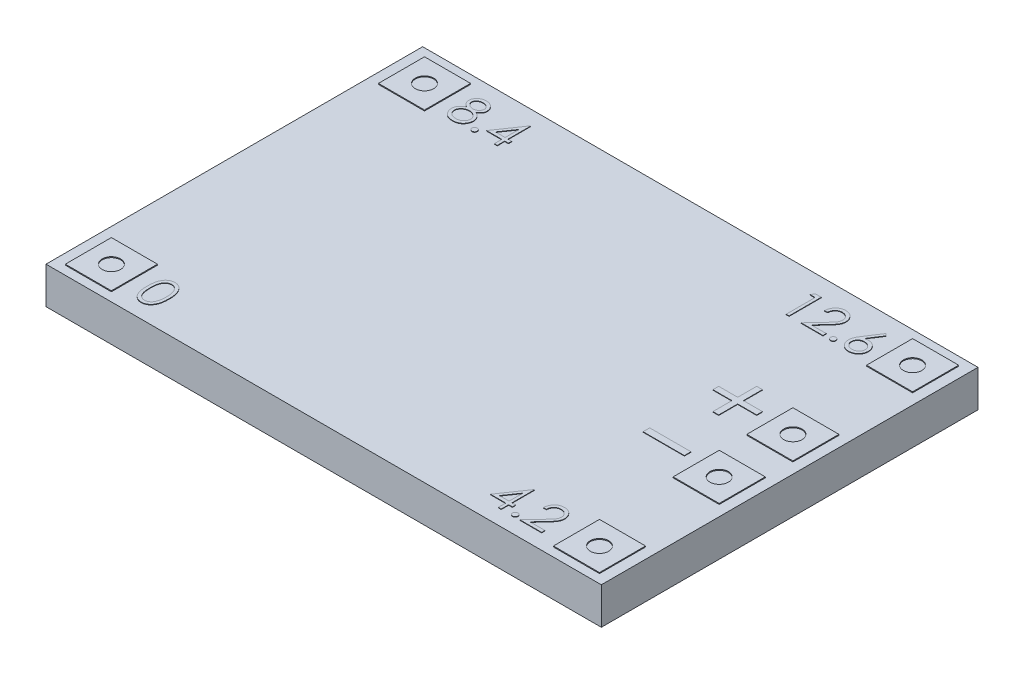
from build123d import *

# Parameters (mm, degrees)
SKETCH_1_W         = 60.3
SKETCH_1_H         = 40.9
EXTRUDE_1_DEPTH    = 4
SKETCH_2_W         = 5
SKETCH_2_H         = 5
SKETCH_2_R         = 1
EXTRUDE_2_DEPTH    = 0.1
EXTRUDE_2_2_DEPTH  = 0.1
EXTRUDE_2_3_DEPTH  = 0.1
EXTRUDE_2_4_DEPTH  = 0.1
EXTRUDE_2_5_DEPTH  = 0.1
EXTRUDE_2_6_DEPTH  = 0.1
EXTRUDE_3_DEPTH    = 0.05
SKETCH_3_W         = 4.487179487
SKETCH_3_H         = 0.717948718
EXTRUDE_3_2_DEPTH  = 0.05
EXTRUDE_3_3_DEPTH  = 0.05
EXTRUDE_3_4_DEPTH  = 0.05
EXTRUDE_3_5_DEPTH  = 0.05
EXTRUDE_3_6_DEPTH  = 0.05
EXTRUDE_3_7_DEPTH  = 0.05
EXTRUDE_3_8_DEPTH  = 0.05
EXTRUDE_3_9_DEPTH  = 0.05
EXTRUDE_3_10_DEPTH = 0.05
EXTRUDE_3_11_DEPTH = 0.05
EXTRUDE_3_12_DEPTH = 0.05
EXTRUDE_3_13_DEPTH = 0.05


with BuildPart() as part:
    # Эскиз1 → Бобышка-Вытянуть1 (new body)
    with BuildSketch(Plane(origin=(0, 0, 0), x_dir=(1, 0, 0), z_dir=(0, 1, 0))):
        Rectangle(SKETCH_1_W, SKETCH_1_H)
    extrude(amount=EXTRUDE_1_DEPTH)


with BuildPart() as body_2:
    # Эскиз2 → Бобышка-Вытянуть2 (new body)
    with BuildSketch(Plane(origin=(0, 4, 0), x_dir=(1, 0, 0), z_dir=(0, 1, 0))):
        with Locations((-26.5, -17)):
            Rectangle(SKETCH_2_W, SKETCH_2_H)
        with Locations(Location((-26.5, -17, 0), (0, 0, 270))):
            Circle(SKETCH_2_R, mode=Mode.SUBTRACT)
    extrude(amount=EXTRUDE_2_DEPTH)


with BuildPart() as body_3:
    # Эскиз2 → Extrude 2 2 (new body)
    with BuildSketch(Plane(origin=(0, 4, 0), x_dir=(1, 0, 0), z_dir=(0, 1, 0))):
        with Locations((-26.5, 17)):
            Rectangle(SKETCH_2_W, SKETCH_2_H)
        with Locations(Location((-26.5, 17, 0), (0, 0, 90))):
            Circle(SKETCH_2_R, mode=Mode.SUBTRACT)
    extrude(amount=EXTRUDE_2_2_DEPTH)


with BuildPart() as body_4:
    # Эскиз2 → Extrude 2 3 (new body)
    with BuildSketch(Plane(origin=(0, 4, 0), x_dir=(1, 0, 0), z_dir=(0, 1, 0))):
        with Locations((26.5, 17)):
            Rectangle(SKETCH_2_W, SKETCH_2_H)
        with Locations(Location((26.5, 17, 0), (0, 0, 270))):
            Circle(SKETCH_2_R, mode=Mode.SUBTRACT)
    extrude(amount=EXTRUDE_2_3_DEPTH)


with BuildPart() as body_5:
    # Эскиз2 → Extrude 2 4 (new body)
    with BuildSketch(Plane(origin=(0, 4, 0), x_dir=(1, 0, 0), z_dir=(0, 1, 0))):
        with Locations((26.5, -17)):
            Rectangle(SKETCH_2_W, SKETCH_2_H)
        with Locations(Location((26.5, -17, 0), (0, 0, 90))):
            Circle(SKETCH_2_R, mode=Mode.SUBTRACT)
    extrude(amount=EXTRUDE_2_4_DEPTH)


with BuildPart() as body_6:
    # Эскиз2 → Extrude 2 5 (new body)
    with BuildSketch(Plane(origin=(0, 4, 0), x_dir=(1, 0, 0), z_dir=(0, 1, 0))):
        with Locations((26.5, 4)):
            Rectangle(SKETCH_2_W, SKETCH_2_H)
        with Locations(Location((26.5, 4, 0), (0, 0, 270))):
            Circle(SKETCH_2_R, mode=Mode.SUBTRACT)
    extrude(amount=EXTRUDE_2_5_DEPTH)


with BuildPart() as body_7:
    # Эскиз2 → Extrude 2 6 (new body)
    with BuildSketch(Plane(origin=(0, 4, 0), x_dir=(1, 0, 0), z_dir=(0, 1, 0))):
        with Locations((26.5, -4)):
            Rectangle(SKETCH_2_W, SKETCH_2_H)
        with Locations(Location((26.5, -4, 0), (0, 0, 270))):
            Circle(SKETCH_2_R, mode=Mode.SUBTRACT)
    extrude(amount=EXTRUDE_2_6_DEPTH)


with BuildPart() as body_8:
    # Эскиз3 → Бобышка-Вытянуть3 (new body)
    with BuildSketch(Plane(origin=(0, 4, 0), x_dir=(1, 0, 0), z_dir=(0, 1, 0))):
        Polygon((19.969849087, 4.535068016), (19.969849087, 6.59917058), (20.598054215, 6.59917058), (20.598054215, 4.535068016), (22.662156779, 4.535068016), (22.662156779, 3.906862888), (20.598054215, 3.906862888), (20.598054215, 1.842760324), (19.969849087, 1.842760324), (19.969849087, 3.906862888), (17.905746523, 3.906862888), (17.905746523, 4.535068016), align=None)
    extrude(amount=EXTRUDE_3_DEPTH)


with BuildPart() as body_9:
    # Эскиз3 → Extrude 3 2 (new body)
    with BuildSketch(Plane(origin=(0, 4, 0), x_dir=(1, 0, 0), z_dir=(0, 1, 0))):
        with Locations((20.312976952, -3.479588137)):
            Rectangle(SKETCH_3_W, SKETCH_3_H)
    extrude(amount=EXTRUDE_3_2_DEPTH)


with BuildPart() as body_10:
    # Эскиз3 → Extrude 3 3 (new body)
    with BuildSketch(Plane(origin=(0, 4, 0), x_dir=(1, 0, 0), z_dir=(0, 1, 0))):
        Polygon((14.459435764, 18.478011487), (15.106571181, 18.478011487), (15.106571181, 14.978011487), (14.792468617, 14.978011487), (14.792468617, 18.119037128), (14.254007078, 18.119037128), align=None)
    extrude(amount=EXTRUDE_3_3_DEPTH)


with BuildPart() as body_11:
    # Эскиз3 → Extrude 3 4 (new body)
    with BuildSketch(Plane(origin=(0, 4, 0), x_dir=(1, 0, 0), z_dir=(0, 1, 0))):
        with BuildLine():
            Line((16.856571181, 17.40108841), (16.542468617, 17.40108841))
            add(Edge.make_bspline(
                [(16.542468617, 17.40108841), (16.54451577, 17.442759298), (16.548536324, 17.524599812), (16.567364613, 17.643923719), (16.59430549, 17.757978517), (16.632396944, 17.865848431), (16.679703222, 17.968487239), (16.736433249, 18.065487254), (16.8036271, 18.156478443), (16.879833834, 18.240617286), (16.962602473, 18.317804857), (17.051908412, 18.3844601), (17.14575344, 18.440777771), (17.243852839, 18.487859013), (17.347313402, 18.523198859), (17.45519626, 18.549420499), (17.567975396, 18.565196844), (17.644815418, 18.56689263), (17.683894899, 18.567755077)],
                knots=[0, 0, 0, 0, 1.10065271, 2.161652631, 3.183658789, 4.190468796, 5.17591951, 6.163126047, 7.15150782, 8.156236427, 9.156009102, 10.134482811, 11.092018607, 12.041330605, 13.001268258, 13.972401359, 14.968799086, 16, 16, 16, 16], degree=3))
            add(Edge.make_bspline(
                [(17.683894899, 18.567755077), (17.722272973, 18.56685662), (17.797684517, 18.565091185), (17.907746532, 18.549930156), (18.012523826, 18.526184564), (18.111811593, 18.492869148), (18.204817657, 18.448084721), (18.292240702, 18.394287182), (18.375121513, 18.332067351), (18.449728296, 18.258813537), (18.518236376, 18.180611153), (18.577338631, 18.097123249), (18.627951794, 18.010893963), (18.670139474, 17.921265762), (18.701195613, 17.827394733), (18.724773821, 17.730647531), (18.738101235, 17.63002272), (18.740146658, 17.561916164), (18.741186565, 17.527290333)],
                knots=[0, 0, 0, 0, 1.111607364, 2.184268762, 3.212621178, 4.221274766, 5.211760367, 6.196651075, 7.1921475, 8.207485113, 9.220403448, 10.201281604, 11.166441695, 12.114753415, 13.065576456, 14.026450734, 14.996634279, 16, 16, 16, 16], degree=3))
            add(Edge.make_bspline(
                [(18.741186565, 17.527290333), (18.739493302, 17.478542498), (18.736136491, 17.381902285), (18.707422115, 17.239887422), (18.662575603, 17.102294003), (18.608578247, 16.991556701), (18.554105803, 16.902323207), (18.505018295, 16.828854502), (18.447553484, 16.749749034), (18.380874986, 16.665271696), (18.306362114, 16.574760791), (18.22333995, 16.478270996), (18.131216468, 16.376799226), (18.066557968, 16.307493625), (18.033053552, 16.271581198)],
                knots=[0, 0, 0, 0, 1.184426356, 2.348067706, 3.509069118, 4.696110526, 5.333549288, 6.050745305, 6.844228056, 7.710549037, 8.667450064, 9.695053472, 10.805634456, 12, 12, 12, 12], degree=3))
            Line((18.033053552, 16.271581198), (17.157352431, 15.336985846))
            Line((17.157352431, 15.336985846), (18.78605836, 15.336985846))
            Line((18.78605836, 15.336985846), (18.78605836, 14.978011487))
            Line((18.78605836, 14.978011487), (16.407853232, 14.978011487))
            Line((16.407853232, 14.978011487), (17.765225027, 16.426529115))
            add(Edge.make_bspline(
                [(17.765225027, 16.426529115), (17.798272914, 16.461027422), (17.861751141, 16.527291608), (17.951533718, 16.624034568), (18.032172706, 16.713784109), (18.104190099, 16.796370657), (18.166023604, 16.873002225), (18.220895836, 16.941196929), (18.264861427, 17.003951379), (18.312576823, 17.076691993), (18.358790804, 17.16550431), (18.39850316, 17.274037999), (18.422718009, 17.385765252), (18.425622844, 17.461267289), (18.427084001, 17.499245461)],
                knots=[0, 0, 0, 0, 1.329631726, 2.553950428, 3.673215718, 4.687767853, 5.603093632, 6.413772471, 7.123043292, 7.734684054, 8.834405432, 9.900288307, 10.943827018, 12, 12, 12, 12], degree=3))
            add(Edge.make_bspline(
                [(18.427084001, 17.499245461), (18.426448259, 17.52312686), (18.425195333, 17.57019251), (18.414137635, 17.639198269), (18.397427129, 17.705763083), (18.373481871, 17.770091702), (18.341875131, 17.831537354), (18.303401751, 17.890174834), (18.259011688, 17.946863799), (18.207660419, 18.000017097), (18.151248899, 18.048698303), (18.091654649, 18.091822388), (18.028604545, 18.127861499), (17.962364423, 18.157404996), (17.893118953, 18.180580377), (17.820734208, 18.196638957), (17.745410192, 18.206721441), (17.693976696, 18.208085613), (17.667769097, 18.208780718)],
                knots=[0, 0, 0, 0, 0.991446411, 1.95395049, 2.89581595, 3.838931463, 4.798493298, 5.75982156, 6.748411868, 7.785213223, 8.824556874, 9.840280684, 10.836137867, 11.835679398, 12.848801643, 13.863922112, 14.911575587, 16, 16, 16, 16], degree=3))
            add(Edge.make_bspline(
                [(17.667769097, 18.208780718), (17.640398265, 18.208065685), (17.586646468, 18.20666148), (17.507727435, 18.196838816), (17.432441658, 18.179892976), (17.360599755, 18.156716301), (17.292080169, 18.127257752), (17.227216125, 18.090566008), (17.166153236, 18.046782515), (17.108776712, 17.997141958), (17.055912733, 17.941874357), (17.009465858, 17.880264394), (16.968881843, 17.813436979), (16.93347261, 17.741572428), (16.90471692, 17.664018648), (16.882743769, 17.581050943), (16.865356923, 17.493029562), (16.859548402, 17.432244477), (16.856571181, 17.40108841)],
                knots=[0, 0, 0, 0, 1.031018746, 2.02475058, 2.990194455, 3.934040569, 4.864654155, 5.795059489, 6.735614925, 7.690564532, 8.649604399, 9.611025574, 10.590972636, 11.591080095, 12.624614302, 13.701020113, 14.821632451, 16, 16, 16, 16], degree=3))
        make_face()
    extrude(amount=EXTRUDE_3_4_DEPTH)


with BuildPart() as body_12:
    # Эскиз3 → Extrude 3 5 (new body)
    with BuildSketch(Plane(origin=(0, 4, 0), x_dir=(1, 0, 0), z_dir=(0, 1, 0))):
        with BuildLine():
            add(Edge.make_bspline(
                [(19.66105836, 15.516473025), (19.680548572, 15.515314859), (19.718756855, 15.513044408), (19.773995983, 15.497467734), (19.823990643, 15.469809074), (19.868522888, 15.432946296), (19.905229364, 15.388250632), (19.933873716, 15.338654724), (19.949314701, 15.282953131), (19.951568613, 15.244523456), (19.952725027, 15.224806359)],
                knots=[0, 0, 0, 0, 1.020151414, 1.999887582, 2.974338812, 3.990962822, 5.007586832, 5.987933904, 6.967670073, 8, 8, 8, 8], degree=3))
            add(Edge.make_bspline(
                [(19.952725027, 15.224806359), (19.951529426, 15.205563029), (19.949171719, 15.167615465), (19.933909111, 15.112334002), (19.905011061, 15.062707098), (19.868776068, 15.01740496), (19.823979634, 14.980464089), (19.773877788, 14.953040745), (19.71888653, 14.936348765), (19.680570206, 14.934222468), (19.66105836, 14.933139692)],
                knots=[0, 0, 0, 0, 1.009421747, 1.99056486, 2.972319754, 3.999869655, 5.017953583, 5.993804169, 6.978383603, 8, 8, 8, 8], degree=3))
            add(Edge.make_bspline(
                [(19.66105836, 14.933139692), (19.641532455, 14.934183289), (19.603412772, 14.936220664), (19.548626778, 14.95338347), (19.498219809, 14.980206931), (19.453432097, 15.01747384), (19.416893626, 15.062473984), (19.389268243, 15.11267578), (19.372678094, 15.167457217), (19.370496221, 15.20553186), (19.369391693, 15.224806359)],
                knots=[0, 0, 0, 0, 1.022052826, 1.995314843, 2.982371812, 4.00089066, 5.028879526, 6.005146991, 6.990147033, 8, 8, 8, 8], degree=3))
            add(Edge.make_bspline(
                [(19.369391693, 15.224806359), (19.370453793, 15.244555738), (19.372527411, 15.283113978), (19.389303071, 15.338313086), (19.416679283, 15.388481525), (19.453684678, 15.432878105), (19.498208974, 15.470065408), (19.548505179, 15.497130201), (19.60354472, 15.513170613), (19.641554658, 15.51535313), (19.66105836, 15.516473025)],
                knots=[0, 0, 0, 0, 1.032775665, 2.016367738, 2.991239715, 4.008302682, 5.025365648, 6.011011707, 6.979408107, 8, 8, 8, 8], degree=3))
        make_face()
    extrude(amount=EXTRUDE_3_5_DEPTH)


with BuildPart() as body_13:
    # Эскиз3 → Extrude 3 6 (new body)
    with BuildSketch(Plane(origin=(0, 4, 0), x_dir=(1, 0, 0), z_dir=(0, 1, 0))):
        with BuildLine():
            Line((22.016827591, 18.567755077), (22.25871461, 18.37775107))
            Line((22.25871461, 18.37775107), (21.333934963, 16.96358841))
            add(Edge.make_bspline(
                [(21.333934963, 16.96358841), (21.39550524, 16.97340227), (21.515605026, 16.992545315), (21.637170925, 16.995703261), (21.696414931, 16.997242256)],
                knots=[0, 0, 0, 0, 1.025318673, 2, 2, 2, 2], degree=3))
            add(Edge.make_bspline(
                [(21.696414931, 16.997242256), (21.731987427, 16.996286144), (21.802010827, 16.994404067), (21.90481763, 16.979920216), (22.003606566, 16.957095104), (22.097968178, 16.923822848), (22.18824116, 16.881320494), (22.274943556, 16.830381624), (22.356445566, 16.768375943), (22.433796745, 16.699110988), (22.504023843, 16.622394003), (22.566199898, 16.540992666), (22.61842669, 16.454991785), (22.660800611, 16.364434919), (22.69370549, 16.26946166), (22.717693135, 16.17019352), (22.731872728, 16.066562049), (22.733798219, 15.996083874), (22.734776309, 15.960283121)],
                knots=[0, 0, 0, 0, 1.04369286, 2.054478336, 3.041073146, 4.015093852, 4.984733326, 5.965804835, 6.960378782, 7.985147595, 9.009457201, 10.008161701, 10.986880575, 11.956520048, 12.937015923, 13.931873656, 14.949455224, 16, 16, 16, 16], degree=3))
            add(Edge.make_bspline(
                [(22.734776309, 15.960283121), (22.733353204, 15.911303417), (22.73055287, 15.814922951), (22.702649074, 15.674546245), (22.65928943, 15.54081373), (22.597311901, 15.415860558), (22.520329518, 15.299857989), (22.426451926, 15.197072523), (22.319008437, 15.105402486), (22.197521639, 15.028745867), (22.066778675, 14.966142816), (21.929426677, 14.921177574), (21.786799531, 14.893494104), (21.689994923, 14.890023501), (21.641026309, 14.888267897)],
                knots=[0, 0, 0, 0, 1.031375318, 2.029502543, 3.004789286, 3.987476834, 4.960371455, 5.9300674, 6.912260825, 7.929083631, 8.949397511, 9.960523116, 10.96833055, 12, 12, 12, 12], degree=3))
            add(Edge.make_bspline(
                [(21.641026309, 14.888267897), (21.593929608, 14.889796103), (21.50063929, 14.892823211), (21.363406496, 14.919789149), (21.231543479, 14.963496251), (21.105974098, 15.02371053), (20.989653485, 15.099768413), (20.885587848, 15.191330692), (20.794296074, 15.296440157), (20.718321453, 15.415080504), (20.658062721, 15.542570462), (20.612872796, 15.675507618), (20.586476553, 15.8134076), (20.582787996, 15.906888739), (20.580930155, 15.953973025)],
                knots=[0, 0, 0, 0, 1.012016664, 2.004627821, 2.994792927, 3.992885782, 4.990978636, 5.973936114, 6.964471063, 7.975201453, 8.993600317, 9.990122807, 10.98767138, 12, 12, 12, 12], degree=3))
            add(Edge.make_bspline(
                [(20.580930155, 15.953973025), (20.5821116, 15.990017608), (20.584523885, 16.06361376), (20.601367275, 16.175077788), (20.62843207, 16.28912887), (20.658742316, 16.385883064), (20.690767927, 16.465144586), (20.717420466, 16.529048076), (20.750594462, 16.59480915), (20.785967843, 16.664682785), (20.826724712, 16.736868218), (20.871040362, 16.812571888), (20.920140013, 16.890589815), (20.954560175, 16.943534011), (20.972156117, 16.970599628)],
                knots=[0, 0, 0, 0, 1.173818275, 2.396712641, 3.66331629, 4.989737886, 5.693666774, 6.447286557, 7.243889047, 8.091586357, 8.998013824, 9.943181721, 10.948533338, 12, 12, 12, 12], degree=3))
            Line((20.972156117, 16.970599628), (22.016827591, 18.567755077))
        make_face()
        with BuildLine():
            add(Edge.make_bspline(
                [(21.630509482, 16.638267897), (21.603847237, 16.637489853), (21.551768128, 16.635970108), (21.475360713, 16.627144856), (21.403047462, 16.610525791), (21.333870328, 16.589359459), (21.269122625, 16.560256399), (21.208333785, 16.5249046), (21.151268733, 16.483283422), (21.098525182, 16.435982511), (21.050705518, 16.384194478), (21.009524387, 16.328724955), (20.974001987, 16.270910752), (20.945120168, 16.21026881), (20.922630093, 16.146822311), (20.906361842, 16.080863061), (20.897308091, 16.011948755), (20.895801859, 15.965216252), (20.895032719, 15.941352833)],
                knots=[0, 0, 0, 0, 1.129588631, 2.206414736, 3.251139165, 4.268635594, 5.265702196, 6.250456724, 7.242448911, 8.251968645, 9.246821453, 10.222880186, 11.173611482, 12.116736599, 13.062300278, 14.020270554, 14.989073742, 16, 16, 16, 16], degree=3))
            add(Edge.make_bspline(
                [(20.895032719, 15.941352833), (20.895659081, 15.917702853), (20.896887282, 15.871328763), (20.908039602, 15.802989584), (20.925074684, 15.737224675), (20.95041508, 15.674373077), (20.980641968, 15.613476758), (21.020547293, 15.556741473), (21.064764078, 15.500721403), (21.117618012, 15.449719932), (21.174341375, 15.402263307), (21.234942577, 15.360783054), (21.298102537, 15.32529688), (21.364673959, 15.297485783), (21.433712343, 15.274661496), (21.505792897, 15.258600017), (21.580965753, 15.249519491), (21.631887691, 15.248011297), (21.657853232, 15.247242256)],
                knots=[0, 0, 0, 0, 0.989467248, 1.94019797, 2.891935182, 3.827694429, 4.772920941, 5.730924762, 6.725747692, 7.756678648, 8.79901574, 9.819492441, 10.826891316, 11.826466727, 12.835195252, 13.867842842, 14.912794438, 16, 16, 16, 16], degree=3))
            add(Edge.make_bspline(
                [(21.657853232, 15.247242256), (21.68381873, 15.248011357), (21.734740585, 15.249519669), (21.809914045, 15.258599338), (21.881992364, 15.274663986), (21.951038873, 15.297476756), (22.017580304, 15.325330366), (22.080685025, 15.360562286), (22.140713119, 15.402518403), (22.197473718, 15.449638832), (22.250107657, 15.501011684), (22.295384935, 15.556241406), (22.334068169, 15.613935301), (22.365502356, 15.674133191), (22.390563647, 15.737262679), (22.407685114, 15.802979403), (22.418814403, 15.871331429), (22.420045769, 15.917703753), (22.420673745, 15.941352833)],
                knots=[0, 0, 0, 0, 1.087397944, 2.132534446, 3.165364764, 4.174271784, 5.174024072, 6.181601208, 7.194203697, 8.236725232, 9.267838612, 10.269026844, 11.221737037, 12.171628256, 13.107553087, 14.05945871, 15.010357665, 16, 16, 16, 16], degree=3))
            add(Edge.make_bspline(
                [(22.420673745, 15.941352833), (22.420123452, 15.965247384), (22.419043406, 16.012144616), (22.406827457, 16.080832235), (22.389885083, 16.147157441), (22.364302052, 16.21070339), (22.331065508, 16.271219317), (22.290582101, 16.329010918), (22.24374953, 16.384521265), (22.189651991, 16.436084074), (22.130761757, 16.483231152), (22.068146171, 16.524850708), (22.002638198, 16.559975685), (21.934304255, 16.589282787), (21.862361373, 16.610432261), (21.787971033, 16.627085504), (21.710181791, 16.635947522), (21.657405183, 16.637484587), (21.630509482, 16.638267897)],
                knots=[0, 0, 0, 0, 0.978206639, 1.919901502, 2.851605144, 3.780102724, 4.718870031, 5.675451981, 6.667674623, 7.690630536, 8.733308323, 9.756129687, 10.767539656, 11.776269907, 12.797430371, 13.836405707, 14.897401972, 16, 16, 16, 16], degree=3))
        make_face(mode=Mode.SUBTRACT)
    extrude(amount=EXTRUDE_3_6_DEPTH)


with BuildPart() as body_14:
    # Эскиз3 → Extrude 3 7 (new body)
    with BuildSketch(Plane(origin=(0, 4, 0), x_dir=(1, 0, 0), z_dir=(0, 1, 0))):
        with BuildLine():
            add(Edge.make_bspline(
                [(-21.036907543, 17.122772779), (-21.008258996, 17.107834824), (-20.952384762, 17.078700821), (-20.872807554, 17.031789993), (-20.800082552, 16.982349028), (-20.73219199, 16.932713169), (-20.67032864, 16.880981517), (-20.615184227, 16.826948361), (-20.565396607, 16.771962416), (-20.521969823, 16.715092576), (-20.483772986, 16.656489926), (-20.450760851, 16.596000653), (-20.422543648, 16.53375732), (-20.400180709, 16.46908049), (-20.381758918, 16.402920228), (-20.369083313, 16.334422246), (-20.362266395, 16.264037905), (-20.360977581, 16.216469604), (-20.360325011, 16.192384158)],
                knots=[0, 0, 0, 0, 1.272397273, 2.481599622, 3.635517121, 4.734568067, 5.792894095, 6.808321871, 7.773003508, 8.711915296, 9.623354172, 10.525449501, 11.423591555, 12.311487226, 13.218079475, 14.126165749, 15.051214107, 16, 16, 16, 16], degree=3))
            add(Edge.make_bspline(
                [(-20.360325011, 16.192384158), (-20.361096432, 16.158686425), (-20.362623363, 16.091985968), (-20.375923347, 15.993539857), (-20.395836325, 15.897928075), (-20.424915837, 15.805171584), (-20.462629228, 15.715782211), (-20.509106064, 15.629683437), (-20.561717269, 15.545464128), (-20.603969509, 15.493644726), (-20.62534905, 15.467424222)],
                knots=[0, 0, 0, 0, 1.025265484, 2.029385089, 3.018602448, 3.995076438, 4.983346944, 5.966715145, 6.97116228, 8, 8, 8, 8], degree=3))
            add(Edge.make_bspline(
                [(-20.62534905, 15.467424222), (-20.653185524, 15.436830448), (-20.70851449, 15.376020955), (-20.803297417, 15.297070145), (-20.907319301, 15.230720751), (-21.020177634, 15.176648856), (-21.141570735, 15.134562997), (-21.27147274, 15.104320479), (-21.410136893, 15.08699805), (-21.505442364, 15.084494061), (-21.554335428, 15.083209478)],
                knots=[0, 0, 0, 0, 0.954267603, 1.896743057, 2.838368354, 3.796610408, 4.779680527, 5.799409237, 6.871065594, 8, 8, 8, 8], degree=3))
            add(Edge.make_bspline(
                [(-21.554335428, 15.083209478), (-21.601348817, 15.084361956), (-21.692832096, 15.086604561), (-21.825989973, 15.101798993), (-21.950113043, 15.128426859), (-22.065923011, 15.164871469), (-22.172721705, 15.212281697), (-22.270204806, 15.271290106), (-22.359778778, 15.339521548), (-22.438725252, 15.418935626), (-22.508813696, 15.503993499), (-22.570381749, 15.591745108), (-22.621555827, 15.682198466), (-22.664882923, 15.774004833), (-22.698050945, 15.868450987), (-22.721023156, 15.965051), (-22.73561247, 16.063636143), (-22.737553604, 16.130167796), (-22.73853014, 16.163638164)],
                knots=[0, 0, 0, 0, 1.256902934, 2.445805442, 3.576955095, 4.645999104, 5.686449165, 6.692658513, 7.68621702, 8.689161843, 9.678783111, 10.630372946, 11.551080876, 12.453998257, 13.34127905, 14.221779781, 15.105423033, 16, 16, 16, 16], degree=3))
            add(Edge.make_bspline(
                [(-22.73853014, 16.163638164), (-22.737952259, 16.188197356), (-22.736810162, 16.236734988), (-22.728905313, 16.308444316), (-22.716196852, 16.378240451), (-22.698937395, 16.446381195), (-22.675546369, 16.512370467), (-22.647304236, 16.576520941), (-22.614372283, 16.63890504), (-22.576291118, 16.699863921), (-22.531989094, 16.758543433), (-22.481825444, 16.815939428), (-22.424797576, 16.871161295), (-22.361539917, 16.92488372), (-22.292775377, 16.978059694), (-22.216717847, 17.027815422), (-22.135383579, 17.077673387), (-22.077578174, 17.107481712), (-22.047925172, 17.122772779)],
                knots=[0, 0, 0, 0, 0.941657376, 1.861047343, 2.762797495, 3.66048619, 4.553285746, 5.444104102, 6.34607688, 7.256116206, 8.197091036, 9.162375105, 10.176350973, 11.237807142, 12.343728897, 13.50695164, 14.721116704, 16, 16, 16, 16], degree=3))
            add(Edge.make_bspline(
                [(-22.047925172, 17.122772779), (-22.088516546, 17.144907548), (-22.167112809, 17.187766656), (-22.27118225, 17.266513462), (-22.360572874, 17.351801277), (-22.432827591, 17.445431071), (-22.48969982, 17.544477946), (-22.528718424, 17.648322198), (-22.555114908, 17.755038312), (-22.557729735, 17.827944508), (-22.55904296, 17.864559638)],
                knots=[0, 0, 0, 0, 1.166880483, 2.259407225, 3.286803203, 4.280235371, 5.237608625, 6.161067461, 7.076446754, 8, 8, 8, 8], degree=3))
            add(Edge.make_bspline(
                [(-22.55904296, 17.864559638), (-22.557407536, 17.901857197), (-22.554120048, 17.976831794), (-22.527536728, 18.088437917), (-22.484216661, 18.198054482), (-22.425295664, 18.305150195), (-22.351908448, 18.40610041), (-22.263861902, 18.496641356), (-22.163258605, 18.575952838), (-22.050600738, 18.642529011), (-21.929364503, 18.69671267), (-21.801448779, 18.734091093), (-21.669082286, 18.758527209), (-21.578984566, 18.761293864), (-21.533301774, 18.762696658)],
                knots=[0, 0, 0, 0, 0.888701115, 1.786444228, 2.72001202, 3.692817113, 4.693886446, 5.687152267, 6.695133018, 7.739871481, 8.800368666, 9.853104506, 10.91144658, 12, 12, 12, 12], degree=3))
            add(Edge.make_bspline(
                [(-21.533301774, 18.762696658), (-21.488797959, 18.761250315), (-21.401041506, 18.758398291), (-21.272046879, 18.734611413), (-21.148622001, 18.694881893), (-21.031192502, 18.64098467), (-20.921860635, 18.574597729), (-20.825258325, 18.494196855), (-20.739925743, 18.404055304), (-20.669341349, 18.303135701), (-20.61117846, 18.196451507), (-20.570677559, 18.084828986), (-20.544725585, 17.970679927), (-20.541452221, 17.893441923), (-20.539812191, 17.854743933)],
                knots=[0, 0, 0, 0, 1.072916533, 2.115669174, 3.151510826, 4.193348718, 5.225979165, 6.227137561, 7.216255879, 8.211077061, 9.189680878, 10.138522389, 11.067357538, 12, 12, 12, 12], degree=3))
            add(Edge.make_bspline(
                [(-20.539812191, 17.854743933), (-20.541246752, 17.816767269), (-20.544064147, 17.74218326), (-20.567764087, 17.63345674), (-20.6076774, 17.531634701), (-20.662171563, 17.435561749), (-20.733197051, 17.346980251), (-20.819805784, 17.264763781), (-20.921307262, 17.188236953), (-20.997568148, 17.145050588), (-21.036907543, 17.122772779)],
                knots=[0, 0, 0, 0, 0.975232327, 1.915300861, 2.843280834, 3.77672583, 4.742871857, 5.749627742, 6.839139064, 8, 8, 8, 8], degree=3))
        make_face()
        with BuildLine():
            add(Edge.make_bspline(
                [(-21.550829819, 18.403722299), (-21.575380625, 18.403070858), (-21.623412736, 18.401796356), (-21.693841407, 18.395137719), (-21.760813775, 18.382184502), (-21.825029575, 18.36494579), (-21.885608387, 18.341657802), (-21.943372942, 18.314262793), (-21.997340132, 18.280956727), (-22.048161435, 18.243595529), (-22.093912209, 18.202502623), (-22.134516761, 18.159688905), (-22.168244875, 18.114313513), (-22.196885985, 18.067505153), (-22.217667502, 18.017874577), (-22.233231806, 17.9669434), (-22.243753197, 17.914068016), (-22.244541588, 17.877931506), (-22.244940396, 17.859651786)],
                knots=[0, 0, 0, 0, 1.203892937, 2.355340988, 3.463153438, 4.544400666, 5.610487187, 6.640501085, 7.674077295, 8.714426146, 9.728707835, 10.68524104, 11.601827946, 12.495867327, 13.368432065, 14.231010473, 15.105153427, 16, 16, 16, 16], degree=3))
            add(Edge.make_bspline(
                [(-22.244940396, 17.859651786), (-22.244253029, 17.841371276), (-22.242894693, 17.805246363), (-22.232389565, 17.751900497), (-22.216732711, 17.699478861), (-22.192082049, 17.64922795), (-22.162515691, 17.59940459), (-22.126024215, 17.551254004), (-22.082535187, 17.50460862), (-22.033507747, 17.459865178), (-21.980096209, 17.417966415), (-21.923512166, 17.381593234), (-21.864465774, 17.351159123), (-21.803563705, 17.325829719), (-21.740185258, 17.306139781), (-21.674718784, 17.292171135), (-21.607153282, 17.283489138), (-21.561372701, 17.282452117), (-21.538209627, 17.281927427)],
                knots=[0, 0, 0, 0, 0.873023192, 1.725219244, 2.590779336, 3.480155217, 4.391973325, 5.357036234, 6.360879153, 7.436073238, 8.526419356, 9.601555421, 10.645666583, 11.697338044, 12.750135903, 13.812665442, 14.89329948, 16, 16, 16, 16], degree=3))
            add(Edge.make_bspline(
                [(-21.538209627, 17.281927427), (-21.508459523, 17.282800294), (-21.449253155, 17.284537407), (-21.361973824, 17.300688581), (-21.277111179, 17.326094499), (-21.195572275, 17.360854465), (-21.11946769, 17.404482325), (-21.051627621, 17.456715343), (-20.992630729, 17.51634744), (-20.943090118, 17.582450276), (-20.904680272, 17.652801864), (-20.874778464, 17.723402157), (-20.857317249, 17.795004388), (-20.855039682, 17.842971352), (-20.853914755, 17.866663004)],
                knots=[0, 0, 0, 0, 1.076279235, 2.141928126, 3.20205304, 4.278698113, 5.344010996, 6.36967002, 7.368914609, 8.37248503, 9.349703398, 10.264243087, 11.142681841, 12, 12, 12, 12], degree=3))
            add(Edge.make_bspline(
                [(-20.853914755, 17.866663004), (-20.854446653, 17.88329104), (-20.855502393, 17.916295308), (-20.864202449, 17.965033673), (-20.878578282, 18.012663257), (-20.898041362, 18.059577527), (-20.923651157, 18.105118259), (-20.954015344, 18.150001347), (-20.990899846, 18.193217111), (-21.032296279, 18.23577266), (-21.079241688, 18.275156683), (-21.1316456, 18.309791394), (-21.18923935, 18.33920375), (-21.2520243, 18.363092505), (-21.319769225, 18.381034855), (-21.392162099, 18.394471202), (-21.469806546, 18.402044314), (-21.523236297, 18.403150839), (-21.550829819, 18.403722299)],
                knots=[0, 0, 0, 0, 0.814439003, 1.616544685, 2.417341072, 3.248991801, 4.09997495, 4.973547432, 5.9003056, 6.880240646, 7.880314356, 8.896779544, 9.951930927, 11.043077905, 12.18215768, 13.381699519, 14.647792085, 16, 16, 16, 16], degree=3))
        make_face(mode=Mode.SUBTRACT)
        with BuildLine():
            add(Edge.make_bspline(
                [(-21.530497287, 16.922953068), (-21.561623073, 16.922399427), (-21.622684269, 16.921313317), (-21.712141197, 16.909223817), (-21.797994363, 16.892394424), (-21.879954299, 16.866863585), (-21.957986396, 16.833667095), (-22.032513079, 16.793732555), (-22.102964208, 16.746527112), (-22.168366934, 16.692650496), (-22.228090264, 16.634591042), (-22.280488564, 16.573128907), (-22.324986084, 16.509406375), (-22.360819335, 16.442614145), (-22.390231067, 16.374166534), (-22.409544945, 16.302358939), (-22.421926656, 16.228571826), (-22.423589288, 16.178411727), (-22.424427576, 16.153121337)],
                knots=[0, 0, 0, 0, 1.140299081, 2.23698856, 3.303958914, 4.344563908, 5.37730929, 6.408454204, 7.439741482, 8.480804886, 9.510774543, 10.48932336, 11.43758569, 12.353841022, 13.263987381, 14.161954604, 15.073269652, 16, 16, 16, 16], degree=3))
            add(Edge.make_bspline(
                [(-22.424427576, 16.153121337), (-22.423064317, 16.121690431), (-22.420359643, 16.059332248), (-22.398903004, 15.967169176), (-22.364467469, 15.877948122), (-22.316442253, 15.792396169), (-22.25697468, 15.712446063), (-22.183848212, 15.642757287), (-22.101607375, 15.580835808), (-22.007469521, 15.530755275), (-21.904641055, 15.49076042), (-21.793149326, 15.463204457), (-21.674594407, 15.444963007), (-21.592734815, 15.443124826), (-21.550829819, 15.442183837)],
                knots=[0, 0, 0, 0, 0.898778495, 1.783155532, 2.693654817, 3.627872908, 4.583023416, 5.533784346, 6.509005473, 7.520592997, 8.575161974, 9.658835044, 10.801527049, 12, 12, 12, 12], degree=3))
            add(Edge.make_bspline(
                [(-21.550829819, 15.442183837), (-21.518079451, 15.442812646), (-21.454271232, 15.444037766), (-21.361185283, 15.45485206), (-21.273340735, 15.472001685), (-21.190907936, 15.496945231), (-21.112964097, 15.527395207), (-21.040830742, 15.566567289), (-20.972652215, 15.611119612), (-20.911788093, 15.663977768), (-20.856354884, 15.720457263), (-20.808021591, 15.780247306), (-20.76606404, 15.841722939), (-20.733133084, 15.906273423), (-20.706806831, 15.972660338), (-20.687883276, 16.041495849), (-20.676207061, 16.112991082), (-20.675026165, 16.161490153), (-20.674427576, 16.186074062)],
                knots=[0, 0, 0, 0, 1.224942928, 2.386581632, 3.501229538, 4.569074225, 5.605009692, 6.626002462, 7.634866581, 8.645888296, 9.63523824, 10.59253846, 11.518950513, 12.414518923, 13.29783783, 14.186679152, 15.080837789, 16, 16, 16, 16], degree=3))
            add(Edge.make_bspline(
                [(-20.674427576, 16.186074062), (-20.675333424, 16.209951402), (-20.677119599, 16.257033347), (-20.688456291, 16.326799873), (-20.708372168, 16.394202688), (-20.735699565, 16.460052694), (-20.772080527, 16.523015644), (-20.814925397, 16.584731816), (-20.866619516, 16.64348826), (-20.925032112, 16.699741356), (-20.988691073, 16.751757093), (-21.056358218, 16.797771532), (-21.12751268, 16.836523648), (-21.20200389, 16.868040143), (-21.279666446, 16.892827613), (-21.360443225, 16.910143608), (-21.4444288, 16.921043211), (-21.501483671, 16.922309257), (-21.530497287, 16.922953068)],
                knots=[0, 0, 0, 0, 0.917430815, 1.809013306, 2.70690318, 3.612392954, 4.541220862, 5.495268465, 6.494511384, 7.542276156, 8.608045339, 9.649016899, 10.681629292, 11.715607085, 12.752076957, 13.808767841, 14.885711793, 16, 16, 16, 16], degree=3))
        make_face(mode=Mode.SUBTRACT)
    extrude(amount=EXTRUDE_3_7_DEPTH)


with BuildPart() as body_15:
    # Эскиз3 → Extrude 3 8 (new body)
    with BuildSketch(Plane(origin=(0, 4, 0), x_dir=(1, 0, 0), z_dir=(0, 1, 0))):
        with BuildLine():
            add(Edge.make_bspline(
                [(-19.485325011, 15.711414606), (-19.465834799, 15.71025644), (-19.427626517, 15.707985989), (-19.372387389, 15.692409316), (-19.322392729, 15.664750655), (-19.277860484, 15.627887877), (-19.241154008, 15.583192214), (-19.212509655, 15.533596305), (-19.19706867, 15.477894712), (-19.194814758, 15.439465037), (-19.193658345, 15.41974794)],
                knots=[0, 0, 0, 0, 1.020151414, 1.999887582, 2.974338812, 3.990962822, 5.007586832, 5.987933904, 6.967670073, 8, 8, 8, 8], degree=3))
            add(Edge.make_bspline(
                [(-19.193658345, 15.41974794), (-19.194853946, 15.40050461), (-19.197211653, 15.362557046), (-19.212474261, 15.307275584), (-19.241372311, 15.257648679), (-19.277607304, 15.212346541), (-19.322403737, 15.17540567), (-19.372505584, 15.147982326), (-19.427496842, 15.131290346), (-19.465813165, 15.129164049), (-19.485325011, 15.128081273)],
                knots=[0, 0, 0, 0, 1.009421747, 1.99056486, 2.972319754, 3.999869655, 5.017953583, 5.993804169, 6.978383603, 8, 8, 8, 8], degree=3))
            add(Edge.make_bspline(
                [(-19.485325011, 15.128081273), (-19.504850917, 15.12912487), (-19.5429706, 15.131162245), (-19.597756594, 15.148325052), (-19.648163563, 15.175148512), (-19.692951274, 15.212415421), (-19.729489746, 15.257415565), (-19.757115129, 15.307617361), (-19.773705278, 15.362398799), (-19.77588715, 15.400473441), (-19.776991678, 15.41974794)],
                knots=[0, 0, 0, 0, 1.022052826, 1.995314843, 2.982371812, 4.00089066, 5.028879526, 6.005146991, 6.990147033, 8, 8, 8, 8], degree=3))
            add(Edge.make_bspline(
                [(-19.776991678, 15.41974794), (-19.775929579, 15.439497319), (-19.77385596, 15.478055559), (-19.7570803, 15.533254667), (-19.729704088, 15.583423106), (-19.692698693, 15.627819686), (-19.648174397, 15.665006989), (-19.597878192, 15.692071782), (-19.542838652, 15.708112194), (-19.504828713, 15.710294711), (-19.485325011, 15.711414606)],
                knots=[0, 0, 0, 0, 1.032775665, 2.016367738, 2.991239715, 4.008302682, 5.025365648, 6.011011707, 6.979408107, 8, 8, 8, 8], degree=3))
        make_face()
    extrude(amount=EXTRUDE_3_8_DEPTH)


with BuildPart() as body_16:
    # Эскиз3 → Extrude 3 9 (new body)
    with BuildSketch(Plane(origin=(0, 4, 0), x_dir=(1, 0, 0), z_dir=(0, 1, 0))):
        Polygon((-16.834383505, 18.762696658), (-16.770581422, 18.762696658), (-16.770581422, 16.339619735), (-16.366735268, 16.339619735), (-16.366735268, 15.980645376), (-16.770581422, 15.980645376), (-16.770581422, 15.172953068), (-17.084683986, 15.172953068), (-17.084683986, 15.980645376), (-18.744940396, 15.980645376), align=None)
        Polygon((-17.084683986, 16.339619735), (-17.084683986, 17.859651786), (-18.127953217, 16.339619735), align=None, mode=Mode.SUBTRACT)
    extrude(amount=EXTRUDE_3_9_DEPTH)


with BuildPart() as body_17:
    # Эскиз3 → Extrude 3 10 (new body)
    with BuildSketch(Plane(origin=(0, 4, 0), x_dir=(1, 0, 0), z_dir=(0, 1, 0))):
        with BuildLine():
            add(Edge.make_bspline(
                [(-22.543588558, -17.063264827), (-22.54326054, -17.007167439), (-22.54262336, -16.898197455), (-22.535534939, -16.739412813), (-22.523759597, -16.590452524), (-22.507622224, -16.451309458), (-22.487984244, -16.321947693), (-22.461768757, -16.202712936), (-22.431955955, -16.093053329), (-22.397403509, -15.992611281), (-22.35841572, -15.900033578), (-22.315981459, -15.813608377), (-22.268416665, -15.733466444), (-22.218439752, -15.658328654), (-22.16402768, -15.589424959), (-22.10672889, -15.525782297), (-22.044307014, -15.468871546), (-21.978884005, -15.417025244), (-21.909867541, -15.371575772), (-21.839224875, -15.331543033), (-21.766469769, -15.297343166), (-21.691403586, -15.27045273), (-21.614701028, -15.248241884), (-21.536093961, -15.233052936), (-21.455452597, -15.223496027), (-21.401021163, -15.22258236), (-21.373416283, -15.222118993)],
                knots=[0, 0, 0, 0, 1.646270934, 3.197905019, 4.663502075, 6.030701355, 7.308322542, 8.50163776, 9.611534131, 10.641858119, 11.616356847, 12.558055219, 13.465016945, 14.349605745, 15.204443733, 16.039544428, 16.859896111, 17.680448484, 18.487036065, 19.28249412, 20.06191084, 20.843045899, 21.620316918, 22.403196591, 23.190181807, 24, 24, 24, 24], degree=3))
            add(Edge.make_bspline(
                [(-21.373416283, -15.222118993), (-21.345580804, -15.222606809), (-21.290224795, -15.223576919), (-21.20838442, -15.232900862), (-21.128434738, -15.248371985), (-21.0507166, -15.27029296), (-20.974591613, -15.297488636), (-20.900655206, -15.331575753), (-20.828448124, -15.371254621), (-20.759117837, -15.417878498), (-20.691903221, -15.469860774), (-20.628455258, -15.528623443), (-20.568768172, -15.593573162), (-20.512092867, -15.664015026), (-20.46003727, -15.741300111), (-20.410463837, -15.824084221), (-20.366091802, -15.913815086), (-20.323357126, -16.008995554), (-20.28647014, -16.112259212), (-20.253203894, -16.223023973), (-20.226324926, -16.34259816), (-20.203935653, -16.470354405), (-20.186590758, -16.606761888), (-20.173958115, -16.751528204), (-20.16728503, -16.904748594), (-20.166028329, -17.009506444), (-20.16538343, -17.063264827)],
                knots=[0, 0, 0, 0, 0.810914788, 1.612654377, 2.396697861, 3.181598691, 3.963628158, 4.749916497, 5.551656086, 6.361998678, 7.18212741, 8.025565596, 8.878627764, 9.750805457, 10.657531673, 11.591944965, 12.560506719, 13.57287815, 14.630710178, 15.753379473, 16.941251878, 18.199788006, 19.531962791, 20.947069417, 22.433333509, 24, 24, 24, 24], degree=3))
            add(Edge.make_bspline(
                [(-20.16538343, -17.063264827), (-20.166035015, -17.116788735), (-20.167304601, -17.221077887), (-20.173883307, -17.373608862), (-20.186841939, -17.517606905), (-20.203051927, -17.653417368), (-20.22550289, -17.780474986), (-20.253108056, -17.899219435), (-20.283758379, -18.010163507), (-20.321593173, -18.112398318), (-20.363003883, -18.207350041), (-20.40805908, -18.296017189), (-20.456328906, -18.379183482), (-20.508917651, -18.456183229), (-20.564971064, -18.527561886), (-20.625688853, -18.592059509), (-20.689359438, -18.651230181), (-20.756771854, -18.703881808), (-20.827183405, -18.749966613), (-20.899142482, -18.791180463), (-20.973925865, -18.824413158), (-21.049838818, -18.852948199), (-21.127967184, -18.874748651), (-21.208213575, -18.889822507), (-21.290169811, -18.900394355), (-21.345571376, -18.901200835), (-21.373416283, -18.901606173)],
                knots=[0, 0, 0, 0, 1.561518951, 3.042555995, 4.452378317, 5.7783523, 7.031515105, 8.214008947, 9.334062868, 10.386615937, 11.391082383, 12.354592575, 13.286541444, 14.194233754, 15.072674879, 15.931287219, 16.775624067, 17.606195743, 18.42308326, 19.229000347, 20.022332153, 20.807536673, 21.593273796, 22.3848459, 23.188221202, 24, 24, 24, 24], degree=3))
            add(Edge.make_bspline(
                [(-21.373416283, -18.901606173), (-21.401020397, -18.901139817), (-21.455450322, -18.900220256), (-21.536102747, -18.890706524), (-21.61438519, -18.875411021), (-21.690683944, -18.853994417), (-21.76539046, -18.82777958), (-21.837486746, -18.793625897), (-21.90777443, -18.754291828), (-21.976065986, -18.709496406), (-22.041078147, -18.658174723), (-22.103176752, -18.601410435), (-22.160801771, -18.537787023), (-22.214435867, -18.4683091), (-22.265409955, -18.393615858), (-22.312299329, -18.312687485), (-22.355670183, -18.225844874), (-22.395313673, -18.132526964), (-22.430462337, -18.031372036), (-22.461510045, -17.921222857), (-22.486024202, -17.801107221), (-22.507007158, -17.671989854), (-22.523931541, -17.533315924), (-22.535485866, -17.385010145), (-22.542627181, -17.227164937), (-22.543262252, -17.118895162), (-22.543588558, -17.063264827)],
                knots=[0, 0, 0, 0, 0.810891512, 1.598919785, 2.382837074, 3.152667961, 3.926044502, 4.706494248, 5.493654104, 6.291793342, 7.103789334, 7.925228297, 8.761435821, 9.622817696, 10.50288917, 11.416980706, 12.369136599, 13.353924996, 14.394355917, 15.514179734, 16.714354668, 17.994756427, 19.357759367, 20.818452758, 22.365282078, 24, 24, 24, 24], degree=3))
        make_face()
        with BuildLine():
            add(Edge.make_bspline(
                [(-22.229485994, -17.061862583), (-22.229366547, -17.108611282), (-22.229134724, -17.199341327), (-22.223078523, -17.331184588), (-22.214828291, -17.454154917), (-22.204186994, -17.568408453), (-22.188384046, -17.673558466), (-22.170677258, -17.770328149), (-22.149129168, -17.858205386), (-22.12363415, -17.937793196), (-22.094595054, -18.010442265), (-22.06288919, -18.07804348), (-22.028828467, -18.141395416), (-21.990709316, -18.199929025), (-21.949194253, -18.253835189), (-21.905220994, -18.304068021), (-21.85714841, -18.348865003), (-21.790644667, -18.402591858), (-21.702848193, -18.458110991), (-21.592227738, -18.506457081), (-21.478559287, -18.536839538), (-21.401408037, -18.540703294), (-21.362899456, -18.542631814)],
                knots=[0, 0, 0, 0, 1.459021318, 2.831673884, 4.118529203, 5.306027144, 6.411944654, 7.436330062, 8.375795394, 9.233974572, 10.042671642, 10.816086306, 11.563610507, 12.285937304, 12.993564865, 13.685989202, 14.367179055, 15.041617293, 16.353048772, 17.594441528, 18.799311195, 20, 20, 20, 20], degree=3))
            add(Edge.make_bspline(
                [(-21.362899456, -18.542631814), (-21.324141784, -18.541034033), (-21.246706461, -18.53784177), (-21.133572666, -18.507043033), (-21.023742396, -18.460573493), (-20.937670456, -18.405625988), (-20.872187912, -18.353297659), (-20.825270922, -18.30868301), (-20.782208874, -18.258727143), (-20.741366799, -18.204827847), (-20.703907723, -18.145955363), (-20.669844585, -18.082392788), (-20.638761238, -18.01396361), (-20.621052192, -17.966193871), (-20.611998014, -17.941770436)],
                knots=[0, 0, 0, 0, 1.353760809, 2.704726607, 4.075137775, 5.516104923, 6.260822281, 7.007110065, 7.778089737, 8.566572457, 9.372053459, 10.217411131, 11.088608312, 12, 12, 12, 12], degree=3))
            add(Edge.make_bspline(
                [(-20.611998014, -17.941770436), (-20.601446246, -17.910540696), (-20.580021632, -17.847130932), (-20.552409858, -17.74876728), (-20.530664458, -17.645564516), (-20.511101093, -17.538139399), (-20.497748037, -17.425699698), (-20.487000224, -17.308593314), (-20.480669537, -17.186731952), (-20.479884786, -17.103936961), (-20.479485994, -17.061862583)],
                knots=[0, 0, 0, 0, 0.884706709, 1.796334032, 2.740027952, 3.714592787, 4.726048262, 5.777819803, 6.87074269, 8, 8, 8, 8], degree=3))
            add(Edge.make_bspline(
                [(-20.479485994, -17.061862583), (-20.480036184, -17.019795011), (-20.481112471, -16.937501846), (-20.485226459, -16.816983665), (-20.495850034, -16.702515904), (-20.507649152, -16.593605432), (-20.525046374, -16.490855129), (-20.54380418, -16.393404824), (-20.569005393, -16.302461799), (-20.595925168, -16.216602217), (-20.626735563, -16.136801563), (-20.660651297, -16.062687776), (-20.696873056, -15.993903052), (-20.736215297, -15.93063611), (-20.77821098, -15.872603567), (-20.823968529, -15.820968972), (-20.871672902, -15.774132004), (-20.938490088, -15.720669435), (-21.025964377, -15.66615774), (-21.134810025, -15.61599198), (-21.248080669, -15.587183687), (-21.324654123, -15.583122), (-21.362899456, -15.581093352)],
                knots=[0, 0, 0, 0, 1.31362396, 2.569729283, 3.763502607, 4.902122613, 5.988968491, 7.01645872, 7.998833611, 8.933434873, 9.825090667, 10.667526885, 11.477055099, 12.250526234, 12.991942729, 13.710640831, 14.402115721, 15.076753259, 16.378508321, 17.609869233, 18.806226677, 20, 20, 20, 20], degree=3))
            add(Edge.make_bspline(
                [(-21.362899456, -15.581093352), (-21.401610048, -15.583124799), (-21.479101754, -15.587191393), (-21.593549708, -15.615884647), (-21.70325406, -15.665897613), (-21.790497035, -15.720849985), (-21.857360821, -15.773188297), (-21.904443515, -15.818574751), (-21.948589687, -15.868221005), (-21.989257387, -15.92262292), (-22.02734667, -15.981088287), (-22.062327683, -16.044077052), (-22.093845012, -16.111908416), (-22.122929549, -16.184524852), (-22.148502337, -16.264105796), (-22.1695963, -16.35187479), (-22.189083353, -16.448336681), (-22.202878622, -16.554056189), (-22.215142378, -16.668338343), (-22.223023725, -16.791615661), (-22.229154983, -16.923680041), (-22.229373447, -17.0148792), (-22.229485994, -17.061862583)],
                knots=[0, 0, 0, 0, 1.207732386, 2.417664972, 3.655092373, 4.956220595, 5.625982001, 6.301752483, 6.994047911, 7.697131622, 8.419323945, 9.170223765, 9.943494443, 10.752040957, 11.610060368, 12.549350801, 13.567764191, 14.679664412, 15.874934091, 17.154273443, 18.533957287, 20, 20, 20, 20], degree=3))
        make_face(mode=Mode.SUBTRACT)
    extrude(amount=EXTRUDE_3_10_DEPTH)


with BuildPart() as body_18:
    # Эскиз3 → Extrude 3 11 (new body)
    with BuildSketch(Plane(origin=(0, 4, 0), x_dir=(1, 0, 0), z_dir=(0, 1, 0))):
        Polygon((17.575518242, -15.222118993), (17.639320326, -15.222118993), (17.639320326, -17.645195916), (18.04316648, -17.645195916), (18.04316648, -18.004170275), (17.639320326, -18.004170275), (17.639320326, -18.811862583), (17.325217762, -18.811862583), (17.325217762, -18.004170275), (15.664961351, -18.004170275), align=None)
        Polygon((17.325217762, -17.645195916), (17.325217762, -16.125163865), (16.281948531, -17.645195916), align=None, mode=Mode.SUBTRACT)
    extrude(amount=EXTRUDE_3_11_DEPTH)


with BuildPart() as body_19:
    # Эскиз3 → Extrude 3 12 (new body)
    with BuildSketch(Plane(origin=(0, 4, 0), x_dir=(1, 0, 0), z_dir=(0, 1, 0))):
        with BuildLine():
            add(Edge.make_bspline(
                [(18.91816648, -18.273401045), (18.937656692, -18.274559211), (18.975864974, -18.276829662), (19.031104102, -18.292406336), (19.081098762, -18.320064996), (19.125631007, -18.356927774), (19.162337483, -18.401623437), (19.190981836, -18.451219346), (19.206422821, -18.506920939), (19.208676733, -18.545350614), (19.209833146, -18.565067711)],
                knots=[0, 0, 0, 0, 1.020151414, 1.999887582, 2.974338812, 3.990962822, 5.007586832, 5.987933904, 6.967670073, 8, 8, 8, 8], degree=3))
            add(Edge.make_bspline(
                [(19.209833146, -18.565067711), (19.208637545, -18.584311041), (19.206279838, -18.622258605), (19.19101723, -18.677540067), (19.16211918, -18.727166972), (19.125884187, -18.77246911), (19.081087754, -18.809409981), (19.030985907, -18.836833325), (18.975994649, -18.853525305), (18.937678326, -18.855651602), (18.91816648, -18.856734378)],
                knots=[0, 0, 0, 0, 1.009421747, 1.99056486, 2.972319754, 3.999869655, 5.017953583, 5.993804169, 6.978383603, 8, 8, 8, 8], degree=3))
            add(Edge.make_bspline(
                [(18.91816648, -18.856734378), (18.898640574, -18.855690781), (18.860520891, -18.853653406), (18.805734897, -18.8364906), (18.755327928, -18.809667139), (18.710540217, -18.77240023), (18.674001745, -18.727400086), (18.646376362, -18.67719829), (18.629786213, -18.622416853), (18.627604341, -18.58434221), (18.626499813, -18.565067711)],
                knots=[0, 0, 0, 0, 1.022052826, 1.995314843, 2.982371812, 4.00089066, 5.028879526, 6.005146991, 6.990147033, 8, 8, 8, 8], degree=3))
            add(Edge.make_bspline(
                [(18.626499813, -18.565067711), (18.627561912, -18.545318332), (18.629635531, -18.506760092), (18.646411191, -18.451560984), (18.673787403, -18.401392545), (18.710792798, -18.356995965), (18.755317094, -18.319808662), (18.805613299, -18.292743869), (18.860652839, -18.276703457), (18.898662778, -18.27452094), (18.91816648, -18.273401045)],
                knots=[0, 0, 0, 0, 1.032775665, 2.016367738, 2.991239715, 4.008302682, 5.025365648, 6.011011707, 6.979408107, 8, 8, 8, 8], degree=3))
        make_face()
    extrude(amount=EXTRUDE_3_12_DEPTH)


with BuildPart() as body_20:
    # Эскиз3 → Extrude 3 13 (new body)
    with BuildSketch(Plane(origin=(0, 4, 0), x_dir=(1, 0, 0), z_dir=(0, 1, 0))):
        with BuildLine():
            Line((20.107269044, -16.38878566), (19.79316648, -16.38878566))
            add(Edge.make_bspline(
                [(19.79316648, -16.38878566), (19.795213633, -16.347114772), (19.799234187, -16.265274258), (19.818062476, -16.145950351), (19.845003353, -16.031895553), (19.883094807, -15.924025639), (19.930401085, -15.821386831), (19.987131112, -15.724386816), (20.054324963, -15.633395627), (20.130531697, -15.549256784), (20.213300336, -15.472069213), (20.302606275, -15.40541397), (20.396451303, -15.349096299), (20.494550702, -15.302015057), (20.598011265, -15.266675211), (20.705894123, -15.240453571), (20.818673259, -15.224677226), (20.895513281, -15.22298144), (20.934592762, -15.222118993)],
                knots=[0, 0, 0, 0, 1.10065271, 2.161652631, 3.183658789, 4.190468796, 5.17591951, 6.163126047, 7.15150782, 8.156236427, 9.156009102, 10.134482811, 11.092018607, 12.041330605, 13.001268258, 13.972401359, 14.968799086, 16, 16, 16, 16], degree=3))
            add(Edge.make_bspline(
                [(20.934592762, -15.222118993), (20.972970836, -15.22301745), (21.04838238, -15.224782885), (21.158444395, -15.239943914), (21.263221689, -15.263689506), (21.362509456, -15.297004922), (21.45551552, -15.341789349), (21.542938565, -15.395586888), (21.625819376, -15.457806719), (21.700426159, -15.531060533), (21.768934239, -15.609262917), (21.828036494, -15.692750821), (21.878649657, -15.778980107), (21.920837337, -15.868608308), (21.951893476, -15.962479337), (21.975471684, -16.059226539), (21.988799098, -16.15985135), (21.990844521, -16.227957906), (21.991884428, -16.262583737)],
                knots=[0, 0, 0, 0, 1.111607364, 2.184268762, 3.212621178, 4.221274766, 5.211760367, 6.196651075, 7.1921475, 8.207485113, 9.220403448, 10.201281604, 11.166441695, 12.114753415, 13.065576456, 14.026450734, 14.996634279, 16, 16, 16, 16], degree=3))
            add(Edge.make_bspline(
                [(21.991884428, -16.262583737), (21.990191165, -16.311331572), (21.986834354, -16.407971785), (21.958119978, -16.549986648), (21.913273466, -16.687580067), (21.85927611, -16.798317369), (21.804803666, -16.887550863), (21.755716158, -16.961019568), (21.698251347, -17.040125036), (21.631572849, -17.124602374), (21.557059977, -17.215113279), (21.474037813, -17.311603074), (21.381914331, -17.413074844), (21.317255831, -17.482380445), (21.283751415, -17.518292872)],
                knots=[0, 0, 0, 0, 1.184426356, 2.348067706, 3.509069118, 4.696110526, 5.333549288, 6.050745305, 6.844228056, 7.710549037, 8.667450064, 9.695053472, 10.805634456, 12, 12, 12, 12], degree=3))
            Line((21.283751415, -17.518292872), (20.408050294, -18.452888224))
            Line((20.408050294, -18.452888224), (22.036756223, -18.452888224))
            Line((22.036756223, -18.452888224), (22.036756223, -18.811862583))
            Line((22.036756223, -18.811862583), (19.658551095, -18.811862583))
            Line((19.658551095, -18.811862583), (21.01592289, -17.363344955))
            add(Edge.make_bspline(
                [(21.01592289, -17.363344955), (21.048970777, -17.328846648), (21.112449004, -17.262582462), (21.202231581, -17.165839502), (21.282870569, -17.076089961), (21.354887962, -16.993503412), (21.416721467, -16.916871845), (21.471593699, -16.848677141), (21.51555929, -16.785922691), (21.563274686, -16.713182077), (21.609488667, -16.62436976), (21.649201023, -16.51583607), (21.673415872, -16.404108818), (21.676320707, -16.328606781), (21.677781864, -16.290628609)],
                knots=[0, 0, 0, 0, 1.329631726, 2.553950428, 3.673215718, 4.687767853, 5.603093632, 6.413772471, 7.123043292, 7.734684054, 8.834405432, 9.900288307, 10.943827018, 12, 12, 12, 12], degree=3))
            add(Edge.make_bspline(
                [(21.677781864, -16.290628609), (21.677146122, -16.26674721), (21.675893196, -16.21968156), (21.664835498, -16.150675801), (21.648124992, -16.084110987), (21.624179734, -16.019782368), (21.592572994, -15.958336716), (21.554099614, -15.899699236), (21.509709551, -15.843010271), (21.458358282, -15.789856973), (21.401946762, -15.741175767), (21.342352512, -15.698051682), (21.279302408, -15.662012571), (21.213062286, -15.632469074), (21.143816816, -15.609293692), (21.071432071, -15.593235113), (20.996108055, -15.583152629), (20.944674559, -15.581788457), (20.91846696, -15.581093352)],
                knots=[0, 0, 0, 0, 0.991446411, 1.95395049, 2.89581595, 3.838931463, 4.798493298, 5.75982156, 6.748411868, 7.785213223, 8.824556874, 9.840280684, 10.836137867, 11.835679398, 12.848801643, 13.863922112, 14.911575587, 16, 16, 16, 16], degree=3))
            add(Edge.make_bspline(
                [(20.91846696, -15.581093352), (20.891096128, -15.581808385), (20.837344331, -15.58321259), (20.758425298, -15.593035254), (20.683139521, -15.609981094), (20.611297618, -15.633157769), (20.542778032, -15.662616318), (20.477913988, -15.699308062), (20.416851099, -15.743091555), (20.359474575, -15.792732112), (20.306610596, -15.847999713), (20.260163721, -15.909609676), (20.219579706, -15.976437091), (20.184170473, -16.048301642), (20.155414783, -16.125855422), (20.133441632, -16.208823127), (20.116054786, -16.296844508), (20.110246265, -16.357629593), (20.107269044, -16.38878566)],
                knots=[0, 0, 0, 0, 1.031018746, 2.02475058, 2.990194455, 3.934040569, 4.864654155, 5.795059489, 6.735614925, 7.690564532, 8.649604399, 9.611025574, 10.590972636, 11.591080095, 12.624614302, 13.701020113, 14.821632451, 16, 16, 16, 16], degree=3))
        make_face()
    extrude(amount=EXTRUDE_3_13_DEPTH)


solid = Compound([part.part, body_2.part, body_3.part, body_4.part, body_5.part, body_6.part, body_7.part, body_8.part, body_9.part, body_10.part, body_11.part, body_12.part, body_13.part, body_14.part, body_15.part, body_16.part, body_17.part, body_18.part, body_19.part, body_20.part])
